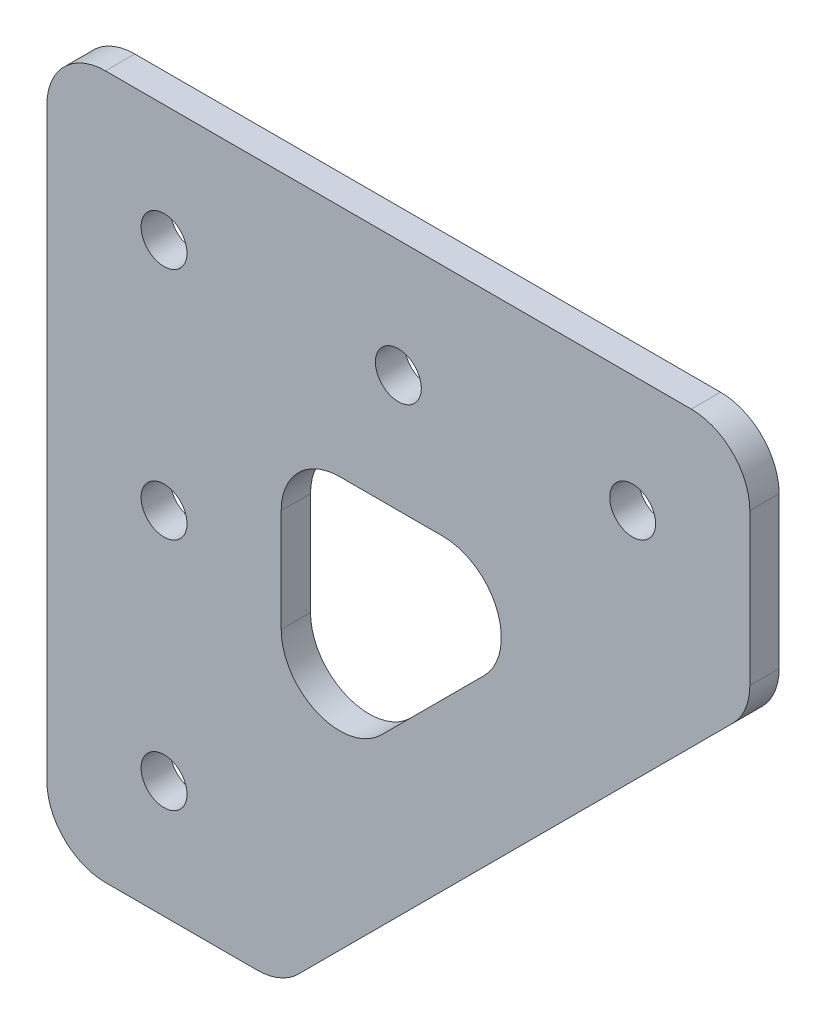
from build123d import *

# Parameters (mm, degrees)
BOSS_EXTRUDE1_DEPTH = 3.175
SKETCH2_R           = 2.4892
CUT_EXTRUDE1_DEPTH  = 108.809835474
FILLET3_R           = 6.35


with BuildPart() as part:
    # Sketch1 → Boss-Extrude1 (new body)
    with BuildSketch(Plane.XY):
        Polygon((25.4, 0), (0, 0), (0, 76.2), (76.2, 76.2), (76.2, 50.8), align=None)
        Polygon((58.239487758, 50.8), (25.4, 50.8), (25.4, 17.960512242), align=None, mode=Mode.SUBTRACT)
    extrude(amount=-BOSS_EXTRUDE1_DEPTH)

    # Sketch2 → Cut-Extrude1 (cut, through all)
    with BuildSketch(Plane.XY):
        with Locations((12.7, 63.5)):
            Circle(SKETCH2_R)
        with Locations((38.1, 63.5)):
            Circle(SKETCH2_R)
        with Locations((63.5, 63.5)):
            Circle(SKETCH2_R)
        with Locations((12.7, 38.1)):
            Circle(SKETCH2_R)
        with Locations((12.7, 12.7)):
            Circle(SKETCH2_R)
    extrude(amount=-CUT_EXTRUDE1_DEPTH, mode=Mode.SUBTRACT)

    # Fillet3
    fillet3_edges = [part.edges().sort_by_distance(p)[0] for p in [
        (25.4, 50.8, -1.5875),
        (25.4, 17.960512242, -1.5875),
        (58.239487758, 50.8, -1.5875),
        (0, 0, -1.5875),
        (0, 76.2, -1.5875),
        (76.2, 76.2, -1.5875),
        (76.2, 50.8, -1.5875),
        (25.4, 0, -1.5875),
    ]]
    fillet(fillet3_edges, radius=FILLET3_R)


solid = part.part
